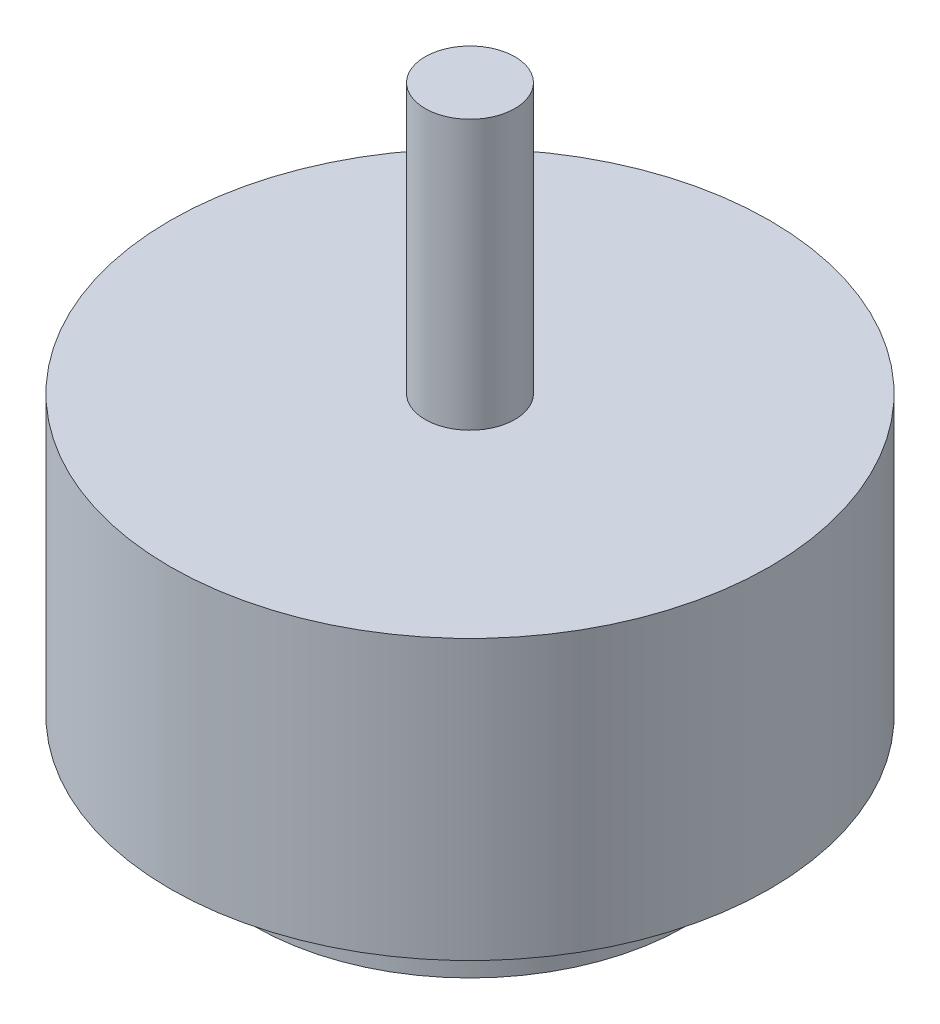
from build123d import *

# Parameters (mm, degrees)
SKETCH4_R           = 2.5
BOSS_EXTRUDE1_DEPTH = 15
SKETCH5_R           = 1.5
CUT_EXTRUDE3_DEPTH  = 4


with BuildPart() as part:
    # Sketch3 → Revolve1 (revolve)
    with BuildSketch(Plane.XY, mode=Mode.PRIVATE) as revolve1_sk:
        Polygon((0, 0), (12, 0), (12, 2), (4.864864865, 2), (4.864864865, 4.162162162), (16.7, 4.162162162), (16.7, 19.7), (0, 19.7), align=None)
    revolve(revolve1_sk.sketch.rotate(Axis((0, 19.7, 0), (0, -1, 0)), 180), axis=Axis((0, 19.7, 0), (0, -1, 0)))

    # Sketch4 → Boss-Extrude1 (add)
    with BuildSketch(Plane(origin=(0, 19.7, 0), x_dir=(1, 0, 0), z_dir=(0, 1, 0))):
        with Locations(Location((0, 0, 0), (0, 0, 180))):
            Circle(SKETCH4_R)
    extrude(amount=BOSS_EXTRUDE1_DEPTH)

    # Sketch5 → Cut-Extrude3 (cut)
    with BuildSketch(Plane.XZ):
        with Locations((9.5, 0)):
            Circle(SKETCH5_R)
        with Locations((0, -9.5)):
            Circle(SKETCH5_R)
        with Locations((-9.5, 0)):
            Circle(SKETCH5_R)
        with Locations((0, 9.5)):
            Circle(SKETCH5_R)
    extrude(amount=-CUT_EXTRUDE3_DEPTH, mode=Mode.SUBTRACT)


solid = part.part
